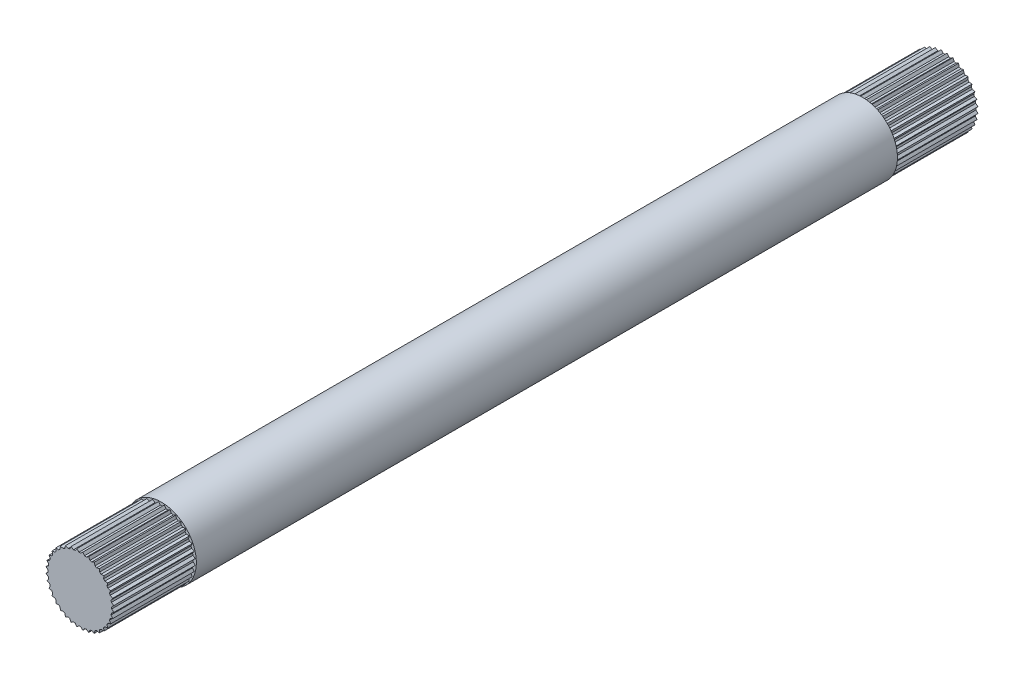
from build123d import *

# Parameters (mm, degrees)
SKETCH5_W           = 1.587499994
SKETCH5_H           = 235.6485
CUT_EXTRUDE7_START  = 257.81
SKETCH8_R           = 12.7
CUT_EXTRUDE7_DEPTH  = 22.225
SKETCH10_R          = 7.9375
BOSS_EXTRUDE1_DEPTH = 210.2485
SKETCH8_2_R         = 12.7
CUT_EXTRUDE8_DEPTH  = 44.4119


with BuildPart() as part:
    # Sketch5 → Revolve2 (revolve)
    with BuildSketch(Plane(origin=(0, 0, 0), x_dir=(1, 0, 0), z_dir=(0, 1, 0)), mode=Mode.PRIVATE) as revolve2_sk:
        with Locations((8.731249997, -139.98575)):
            Rectangle(SKETCH5_W, SKETCH5_H)
    revolve(revolve2_sk.sketch.rotate(Axis((0, 0, 0), (0, 0, 1)), 180), axis=Axis((0, 0, 0), (0, 0, 1)))

    # Sketch8 → Cut-Extrude7 (cut)
    with BuildSketch(Plane.XY.offset(CUT_EXTRUDE7_START)):
        Circle(SKETCH8_R)
        Polygon((9.235721046, -0.808020891), (8.681700155, -0.254), (8.681700155, 0.254), (9.235721046, 0.808020891), (8.593912259, 1.257420242), (8.505698985, 1.75770258), (8.955098336, 2.399511367), (8.245002688, 2.730634406), (8.071256455, 3.207998257), (8.402379494, 3.918093905), (7.645572882, 4.120879625), (7.391572882, 4.56082053), (7.594358603, 5.317627141), (6.813836213, 5.385914002), (6.487300108, 5.775064579), (6.555586968, 6.555586968), (5.775064579, 6.487300108), (5.385914002, 6.813836213), (5.317627141, 7.594358603), (4.56082053, 7.391572882), (4.120879625, 7.645572882), (3.918093905, 8.402379494), (3.207998257, 8.071256455), (2.730634406, 8.245002688), (2.399511367, 8.955098336), (1.75770258, 8.505698985), (1.257420242, 8.593912259), (0.808020891, 9.235721046), (0.254, 8.681700155), (-0.254, 8.681700155), (-0.808020891, 9.235721046), (-1.257420242, 8.593912259), (-1.75770258, 8.505698985), (-2.399511367, 8.955098336), (-2.730634406, 8.245002688), (-3.207998257, 8.071256455), (-3.918093905, 8.402379494), (-4.120879625, 7.645572882), (-4.56082053, 7.391572882), (-5.317627141, 7.594358603), (-5.385914002, 6.813836213), (-5.775064579, 6.487300108), (-6.555586968, 6.555586968), (-6.487300108, 5.775064579), (-6.813836213, 5.385914002), (-7.594358603, 5.317627141), (-7.391572882, 4.56082053), (-7.645572882, 4.120879625), (-8.402379494, 3.918093905), (-8.071256455, 3.207998257), (-8.245002688, 2.730634406), (-8.955098336, 2.399511367), (-8.505698985, 1.75770258), (-8.593912259, 1.257420242), (-9.235721046, 0.808020891), (-8.681700155, 0.254), (-8.681700155, -0.254), (-9.235721046, -0.808020891), (-8.593912259, -1.257420242), (-8.505698985, -1.75770258), (-8.955098336, -2.399511367), (-8.245002688, -2.730634406), (-8.071256455, -3.207998257), (-8.402379494, -3.918093905), (-7.645572882, -4.120879625), (-7.391572882, -4.56082053), (-7.594358603, -5.317627141), (-6.813836213, -5.385914002), (-6.487300108, -5.775064579), (-6.555586968, -6.555586968), (-5.775064579, -6.487300108), (-5.385914002, -6.813836213), (-5.317627141, -7.594358603), (-4.56082053, -7.391572882), (-4.120879625, -7.645572882), (-3.918093905, -8.402379494), (-3.207998257, -8.071256455), (-2.730634406, -8.245002688), (-2.399511367, -8.955098336), (-1.75770258, -8.505698985), (-1.257420242, -8.593912259), (-0.808020891, -9.235721046), (-0.254, -8.681700155), (0.254, -8.681700155), (0.808020891, -9.235721046), (1.257420242, -8.593912259), (1.75770258, -8.505698985), (2.399511367, -8.955098336), (2.730634406, -8.245002688), (3.207998257, -8.071256455), (3.918093905, -8.402379494), (4.120879625, -7.645572882), (4.56082053, -7.391572882), (5.317627141, -7.594358603), (5.385914002, -6.813836213), (5.775064579, -6.487300108), (6.555586968, -6.555586968), (6.487300108, -5.775064579), (6.813836213, -5.385914002), (7.594358603, -5.317627141), (7.391572882, -4.56082053), (7.645572882, -4.120879625), (8.402379494, -3.918093905), (8.071256455, -3.207998257), (8.245002688, -2.730634406), (8.955098336, -2.399511367), (8.505698985, -1.75770258), (8.593912259, -1.257420242), align=None, mode=Mode.SUBTRACT)
    extrude(amount=-CUT_EXTRUDE7_DEPTH, mode=Mode.SUBTRACT)

    # Sketch10 → Boss-Extrude1 (add)
    with BuildSketch(Plane(origin=(0, 0, 47.5615), x_dir=(-1, 0, 0), z_dir=(0, 0, -1))):
        Circle(SKETCH10_R)
    extrude(amount=-BOSS_EXTRUDE1_DEPTH)

    # Sketch8<2> → Cut-Extrude8 (cut)
    with BuildSketch(Plane.XY):
        Circle(SKETCH8_2_R)
        Polygon((9.235721046, -0.808020891), (8.681700155, -0.254), (8.681700155, 0.254), (9.235721046, 0.808020891), (8.593912259, 1.257420242), (8.505698985, 1.75770258), (8.955098336, 2.399511367), (8.245002688, 2.730634406), (8.071256455, 3.207998257), (8.402379494, 3.918093905), (7.645572882, 4.120879625), (7.391572882, 4.56082053), (7.594358603, 5.317627141), (6.813836213, 5.385914002), (6.487300108, 5.775064579), (6.555586968, 6.555586968), (5.775064579, 6.487300108), (5.385914002, 6.813836213), (5.317627141, 7.594358603), (4.56082053, 7.391572882), (4.120879625, 7.645572882), (3.918093905, 8.402379494), (3.207998257, 8.071256455), (2.730634406, 8.245002688), (2.399511367, 8.955098336), (1.75770258, 8.505698985), (1.257420242, 8.593912259), (0.808020891, 9.235721046), (0.254, 8.681700155), (-0.254, 8.681700155), (-0.808020891, 9.235721046), (-1.257420242, 8.593912259), (-1.75770258, 8.505698985), (-2.399511367, 8.955098336), (-2.730634406, 8.245002688), (-3.207998257, 8.071256455), (-3.918093905, 8.402379494), (-4.120879625, 7.645572882), (-4.56082053, 7.391572882), (-5.317627141, 7.594358603), (-5.385914002, 6.813836213), (-5.775064579, 6.487300108), (-6.555586968, 6.555586968), (-6.487300108, 5.775064579), (-6.813836213, 5.385914002), (-7.594358603, 5.317627141), (-7.391572882, 4.56082053), (-7.645572882, 4.120879625), (-8.402379494, 3.918093905), (-8.071256455, 3.207998257), (-8.245002688, 2.730634406), (-8.955098336, 2.399511367), (-8.505698985, 1.75770258), (-8.593912259, 1.257420242), (-9.235721046, 0.808020891), (-8.681700155, 0.254), (-8.681700155, -0.254), (-9.235721046, -0.808020891), (-8.593912259, -1.257420242), (-8.505698985, -1.75770258), (-8.955098336, -2.399511367), (-8.245002688, -2.730634406), (-8.071256455, -3.207998257), (-8.402379494, -3.918093905), (-7.645572882, -4.120879625), (-7.391572882, -4.56082053), (-7.594358603, -5.317627141), (-6.813836213, -5.385914002), (-6.487300108, -5.775064579), (-6.555586968, -6.555586968), (-5.775064579, -6.487300108), (-5.385914002, -6.813836213), (-5.317627141, -7.594358603), (-4.56082053, -7.391572882), (-4.120879625, -7.645572882), (-3.918093905, -8.402379494), (-3.207998257, -8.071256455), (-2.730634406, -8.245002688), (-2.399511367, -8.955098336), (-1.75770258, -8.505698985), (-1.257420242, -8.593912259), (-0.808020891, -9.235721046), (-0.254, -8.681700155), (0.254, -8.681700155), (0.808020891, -9.235721046), (1.257420242, -8.593912259), (1.75770258, -8.505698985), (2.399511367, -8.955098336), (2.730634406, -8.245002688), (3.207998257, -8.071256455), (3.918093905, -8.402379494), (4.120879625, -7.645572882), (4.56082053, -7.391572882), (5.317627141, -7.594358603), (5.385914002, -6.813836213), (5.775064579, -6.487300108), (6.555586968, -6.555586968), (6.487300108, -5.775064579), (6.813836213, -5.385914002), (7.594358603, -5.317627141), (7.391572882, -4.56082053), (7.645572882, -4.120879625), (8.402379494, -3.918093905), (8.071256455, -3.207998257), (8.245002688, -2.730634406), (8.955098336, -2.399511367), (8.505698985, -1.75770258), (8.593912259, -1.257420242), align=None, mode=Mode.SUBTRACT)
    extrude(amount=CUT_EXTRUDE8_DEPTH, mode=Mode.SUBTRACT)


solid = part.part
